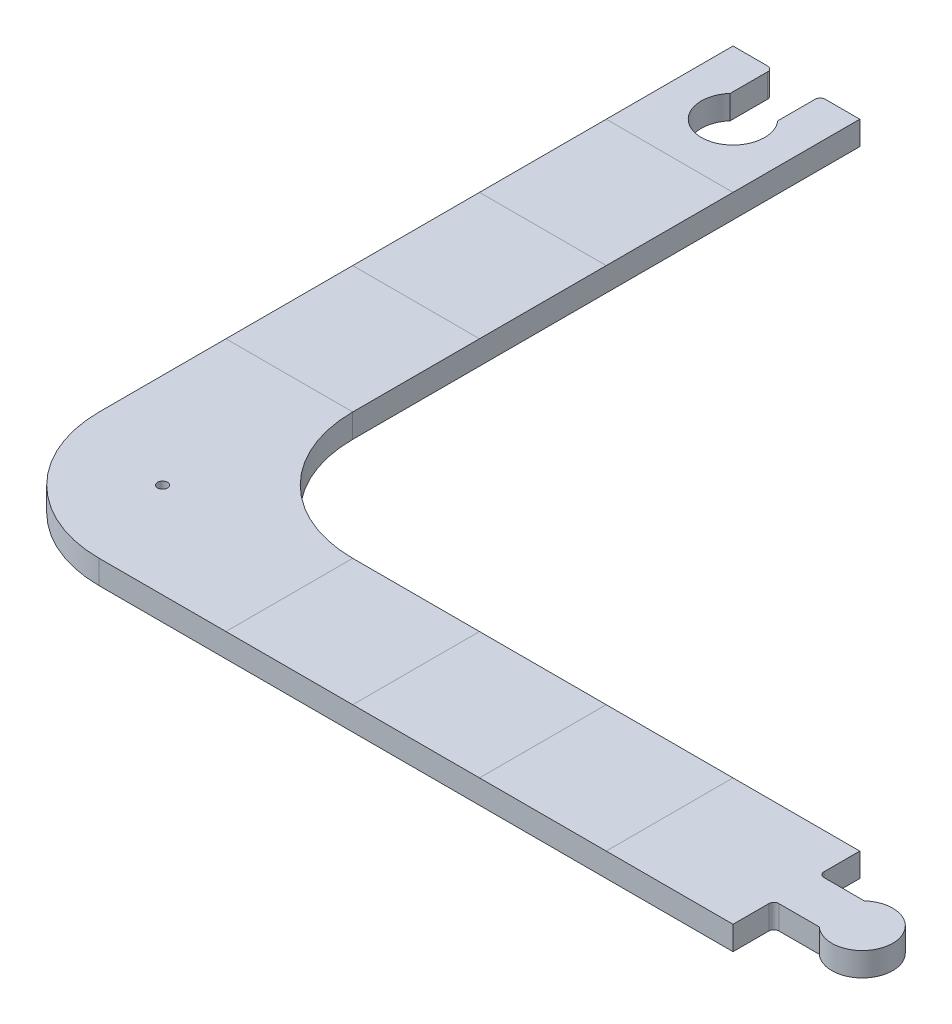
from build123d import *

# Parameters (mm, degrees)
BOSS_EXTRUDE1_DEPTH = 4.7625
SKETCH2_R           = 1
CUT_EXTRUDE1_DEPTH  = 8.89


with BuildPart() as part:
    # Sketch1 → Boss-Extrude1 (new body)
    with BuildSketch(Plane(origin=(0, 0, 0), x_dir=(1, 0, 0), z_dir=(0, 1, 0))):
        with BuildLine():
            Line((25.4, 0), (152.4, 0))
            Line((152.4, 0), (152.4, 7.1875))
            ThreePointArc((152.4, 7.1875), (152.692893219, 7.894606781), (153.4, 8.1875))
            Line((153.4, 8.1875), (161.495448411, 8.1875))
            ThreePointArc((161.495448411, 8.1875), (171.7, 12.7), (161.495448411, 17.2125))
            Line((161.495448411, 17.2125), (153.4, 17.2125))
            ThreePointArc((153.4, 17.2125), (152.692893219, 17.505393219), (152.4, 18.2125))
            Line((152.4, 18.2125), (152.4, 25.4))
            Line((152.4, 25.4), (50.8, 25.4))
            ThreePointArc((50.8, 25.4), (32.839487758, 32.839487758), (25.4, 50.8))
            Line((25.4, 50.8), (25.4, 152.4))
            Line((25.4, 152.4), (18.4625, 152.4))
            ThreePointArc((18.4625, 152.4), (17.755393219, 152.107106781), (17.4625, 151.4))
            Line((17.4625, 151.4), (17.4625, 143.900130206))
            ThreePointArc((17.4625, 143.900130206), (12.7, 133.35), (7.9375, 143.900130206))
            Line((7.9375, 143.900130206), (7.9375, 151.4))
            ThreePointArc((7.9375, 151.4), (7.644606781, 152.107106781), (6.9375, 152.4))
            Line((6.9375, 152.4), (0, 152.4))
            Line((0, 152.4), (0, 25.4))
            ThreePointArc((0, 25.4), (7.439487758, 7.439487758), (25.4, 0))
        make_face()
    extrude(amount=BOSS_EXTRUDE1_DEPTH)

    # Sketch2 → Cut-Extrude1 (cut)
    with BuildSketch(Plane(origin=(0, 4.7625, 0), x_dir=(1, 0, 0), z_dir=(0, 1, 0))):
        with Locations(Location((19.05, 19.05, 0), (0, 0, 270))):
            Circle(SKETCH2_R)
    extrude(amount=-CUT_EXTRUDE1_DEPTH, mode=Mode.SUBTRACT)


solid = part.part
